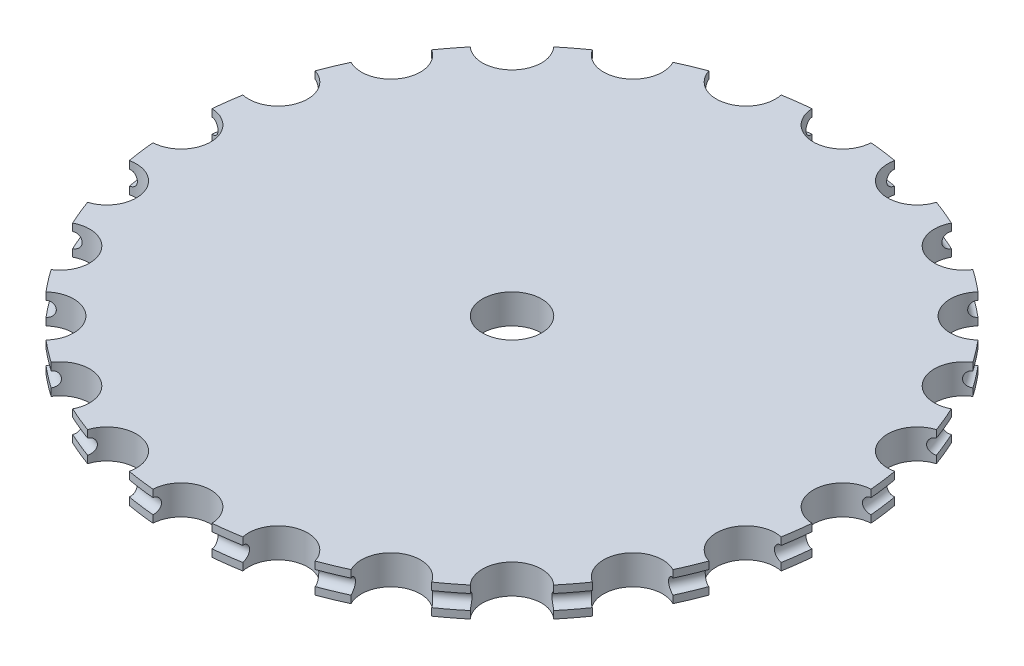
from build123d import *

# Parameters (mm, degrees)
SKETCH4_R          = 3.175
CUT_EXTRUDE2_DEPTH = 3.175
CIRPATTERN1_COUNT  = 24
SKETCH5_R          = 3.175
CUT_EXTRUDE3_DEPTH = 51.189508574


with BuildPart() as part:
    # Sketch3 → Revolve1 (revolve)
    with BuildSketch(Plane.XY, mode=Mode.PRIVATE) as revolve1_sk:
        with BuildLine():
            Line((0, 1.5875), (0, -1.5875))
            Line((0, -1.5875), (35.56, -1.5875))
            Line((35.56, -1.5875), (35.56, -0.79375))
            ThreePointArc((35.56, -0.79375), (34.76625, 0), (35.56, 0.79375))
            Line((35.56, 0.79375), (35.56, 1.5875))
            Line((35.56, 1.5875), (0, 1.5875))
        make_face()
    revolve(revolve1_sk.sketch.rotate(Axis((0, 1.5875, 0), (0, -1, 0)), 180), axis=Axis((0, 1.5875, 0), (0, -1, 0)))

    # Sketch4 → Cut-Extrude2 (cut)
    with BuildSketch(Plane(origin=(0, 1.5875, 0), x_dir=(1, 0, 0), z_dir=(0, 1, 0))):
        with Locations((0, 35.56)):
            Circle(SKETCH4_R)
    cut_extrude2 = extrude(amount=-CUT_EXTRUDE2_DEPTH, mode=Mode.SUBTRACT)

    # CirPattern1: Cut-Extrude2 ×24 about axis
    cirpattern1_axis = Axis((0, 0, 0), (0, 1, 0))
    for i in range(1, CIRPATTERN1_COUNT):
        add(cut_extrude2.rotate(cirpattern1_axis, i * 360 / CIRPATTERN1_COUNT), mode=Mode.SUBTRACT)

    # Sketch5 → Cut-Extrude3 (cut, through all)
    with BuildSketch(Plane(origin=(0, 1.5875, 0), x_dir=(1, 0, 0), z_dir=(0, 1, 0))):
        with Locations(Location((0, 0, 0), (0, 0, 180))):
            Circle(SKETCH5_R)
    extrude(amount=-CUT_EXTRUDE3_DEPTH, mode=Mode.SUBTRACT)


solid = part.part
